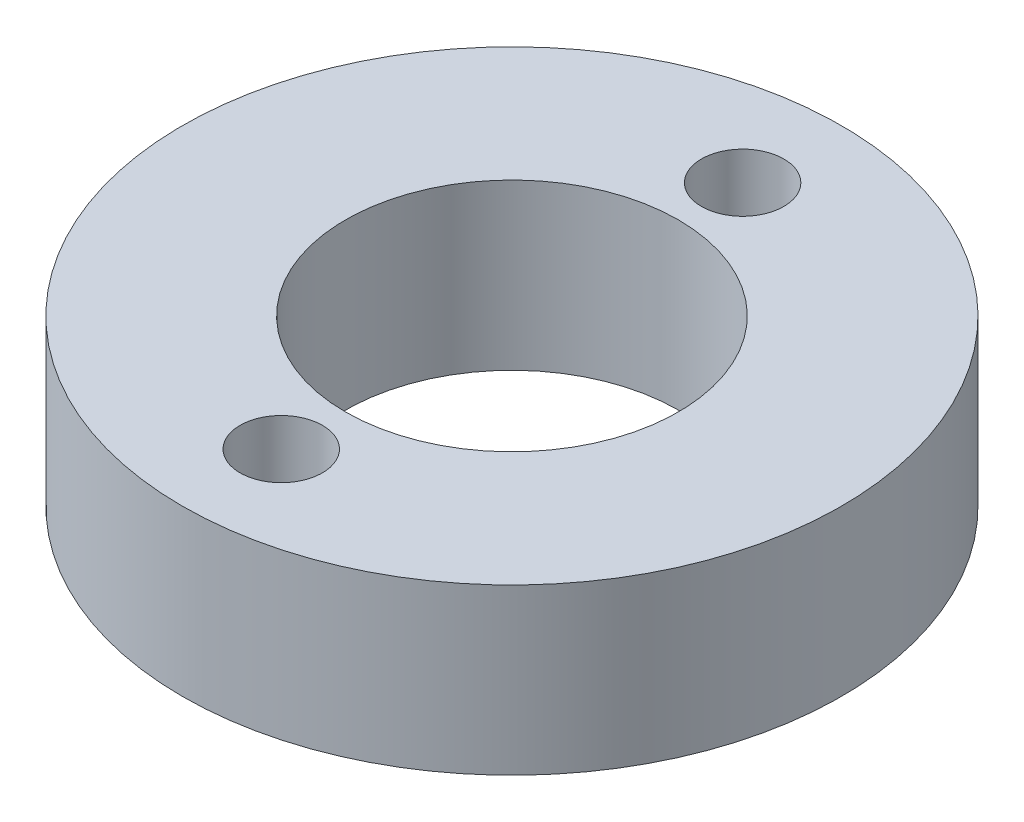
from build123d import *

# Parameters (mm, degrees)
SKETCH1_R           = 10
SKETCH1_R_2         = 5.05
BOSS_EXTRUDE1_DEPTH = 5
SKETCH2_R           = 1.25
CUT_EXTRUDE1_DEPTH  = 2.5
CIRPATTERN1_COUNT   = 2


with BuildPart() as part:
    # Sketch1 → Boss-Extrude1 (new body)
    with BuildSketch(Plane(origin=(0, 0, 0), x_dir=(1, 0, 0), z_dir=(0, 1, 0))):
        with Locations(Location((0, 0, 0), (0, 0, 270))):
            Circle(SKETCH1_R)
        with Locations(Location((0, 0, 0), (0, 0, 270))):
            Circle(SKETCH1_R_2, mode=Mode.SUBTRACT)
    extrude(amount=BOSS_EXTRUDE1_DEPTH)

    # Sketch2 → Cut-Extrude1 (cut)
    with BuildSketch(Plane(origin=(0, 5, 0), x_dir=(1, 0, 0), z_dir=(0, 1, 0))):
        with Locations(Location((0, 7, 0), (0, 0, 270))):
            Circle(SKETCH2_R)
    cut_extrude1 = extrude(amount=-CUT_EXTRUDE1_DEPTH, mode=Mode.SUBTRACT)

    # CirPattern1: Cut-Extrude1 ×2 about axis
    cirpattern1_axis = Axis((0, 0, 0), (0, 1, 0))
    for i in range(1, CIRPATTERN1_COUNT):
        add(cut_extrude1.rotate(cirpattern1_axis, i * 360 / CIRPATTERN1_COUNT), mode=Mode.SUBTRACT)


solid = part.part
